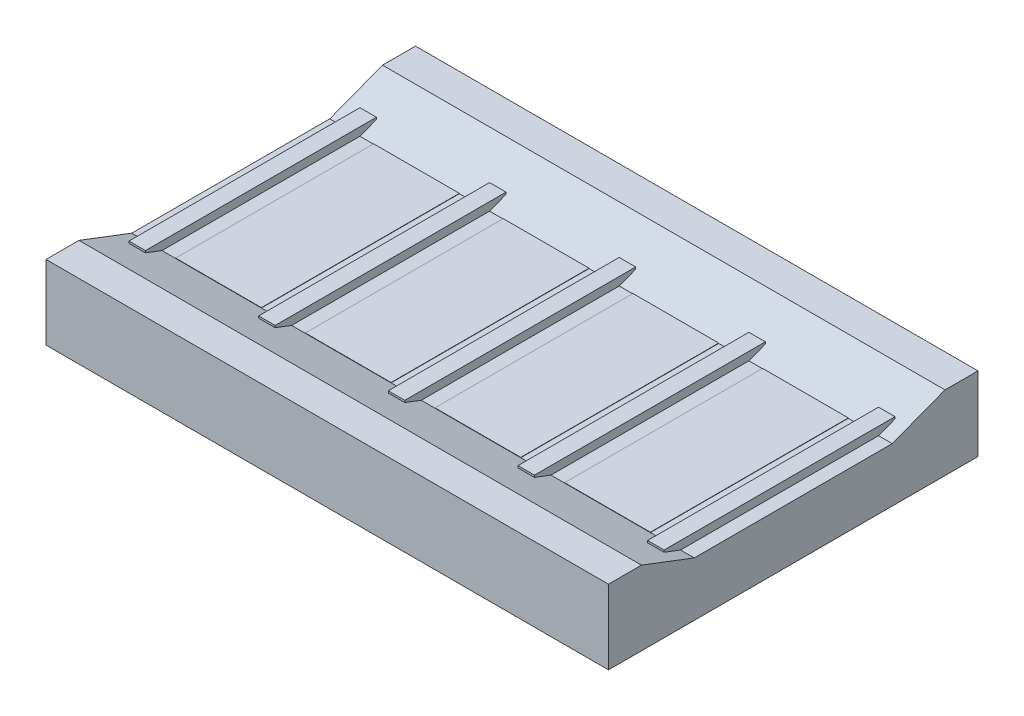
from build123d import *

# Parameters (mm, degrees)
BOSS_EXTRUDE1_DEPTH = 8.525
SKETCH2_W           = 0.5
SKETCH2_H           = 7
BOSS_EXTRUDE2_DEPTH = 0.25
SKETCH3_W           = 2.6
SKETCH3_H           = 6
BOSS_EXTRUDE3_DEPTH = 0.01


with BuildPart() as part:
    # Sketch1 → Boss-Extrude1 (new, symmetric)
    with BuildSketch(Plane(origin=(0, 0, 0), x_dir=(0, 0, -1), z_dir=(1, 0, 0))):
        Polygon((-3, 0.515), (3, 0.515), (4.6, 1.125), (5.6, 1.125), (5.6, -1.125), (-5.6, -1.125), (-5.6, 1.125), (-4.6, 1.125), align=None)
    extrude(amount=BOSS_EXTRUDE1_DEPTH, both=True)

    # Sketch2 → Boss-Extrude2 (add)
    with BuildSketch(Plane(origin=(0, 0.515, 0), x_dir=(1, 0, 0), z_dir=(0, 1, 0))):
        with Locations((-7.86, 0)):
            Rectangle(SKETCH2_W, SKETCH2_H)
        with Locations((-3.93, 0)):
            Rectangle(SKETCH2_W, SKETCH2_H)
        Rectangle(SKETCH2_W, SKETCH2_H)
        with Locations((3.93, 0)):
            Rectangle(SKETCH2_W, SKETCH2_H)
        with Locations((7.86, 0)):
            Rectangle(SKETCH2_W, SKETCH2_H)
    extrude(amount=BOSS_EXTRUDE2_DEPTH)

    # Sketch3 → Boss-Extrude3 (add)
    with BuildSketch(Plane(origin=(0, 0.515, 0), x_dir=(1, 0, 0), z_dir=(0, 1, 0))):
        with Locations((-5.895, 0)):
            Rectangle(SKETCH3_W, SKETCH3_H)
        with Locations((-1.965, 0)):
            Rectangle(SKETCH3_W, SKETCH3_H)
        with Locations((1.965, 0)):
            Rectangle(SKETCH3_W, SKETCH3_H)
        with Locations((5.895, 0)):
            Rectangle(SKETCH3_W, SKETCH3_H)
    extrude(amount=BOSS_EXTRUDE3_DEPTH)


solid = part.part
